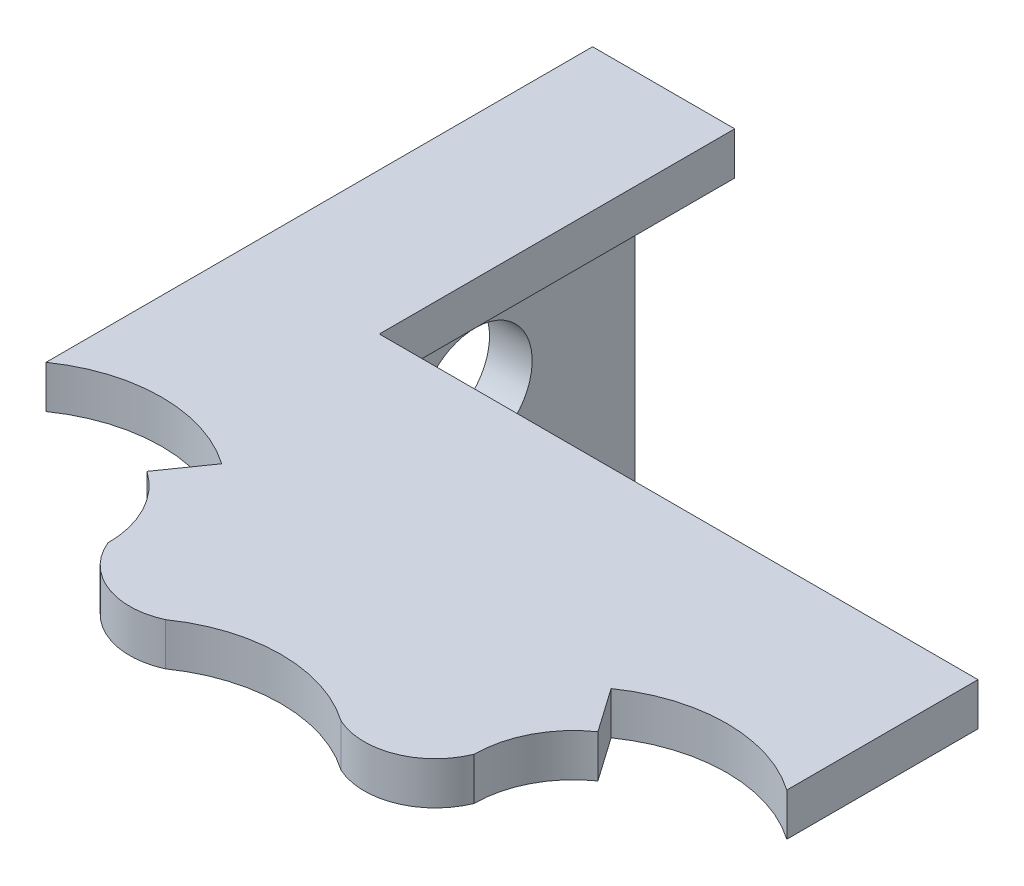
from build123d import *

# Parameters (mm, degrees)
BOSS_EXTRUDE1_DEPTH = 3
SKETCH3_W           = 3
SKETCH3_H           = 22.5
BOSS_EXTRUDE2_DEPTH = 25
SKETCH4_R           = 4
CUT_EXTRUDE1_DEPTH  = 3


with BuildPart() as part:
    # Sketch2 → Boss-Extrude1 (new body)
    with BuildSketch(Plane(origin=(0, 0, 0), x_dir=(1, 0, 0), z_dir=(0, 1, 0))):
        with BuildLine():
            Line((-15.860247962, 17.20906431), (-13.694996915, 20.301363277))
            ThreePointArc((-13.694996915, 20.301363277), (-19.875283017, 22.25), (-26.055569119, 20.301363277))
            Line((-26.055569119, 20.301363277), (-26.055569119, 33.75))
            Line((-26.055569119, 33.75), (-26.055569119, 58.75))
            Line((-26.055569119, 58.75), (-16.055569119, 58.75))
            Line((-16.055569119, 58.75), (-16.055569119, 33.75))
            Line((-16.055569119, 33.75), (26.055569119, 33.75))
            Line((26.055569119, 33.75), (26.055569119, 20.301363277))
            ThreePointArc((26.055569119, 20.301363277), (19.875283017, 22.25), (13.694996915, 20.301363277))
            Line((13.694996915, 20.301363277), (15.860247962, 17.20906431))
            ThreePointArc((15.860247962, 17.20906431), (13.666207185, 14.707240293), (12.875283017, 11.475))
            ThreePointArc((12.875283017, 11.475), (10.090653959, 8.727908609), (6.180286102, 8.826363277))
            ThreePointArc((6.180286102, 8.826363277), (0, 10.775), (-6.180286102, 8.826363277))
            ThreePointArc((-6.180286102, 8.826363277), (-10.090653959, 8.727908609), (-12.875283017, 11.475))
            ThreePointArc((-12.875283017, 11.475), (-13.666207185, 14.707240293), (-15.860247962, 17.20906431))
        make_face()
    extrude(amount=BOSS_EXTRUDE1_DEPTH)

    # Sketch3 → Boss-Extrude2 (add)
    with BuildSketch(Plane.XZ):
        with Locations((-24.555569119, -47.5)):
            Rectangle(SKETCH3_W, SKETCH3_H)
    extrude(amount=BOSS_EXTRUDE2_DEPTH)

    # Sketch4 → Cut-Extrude1 (cut)
    with BuildSketch(Plane.ZY.offset(26.055569119)):
        with Locations((-47.5, -11)):
            Circle(SKETCH4_R)
    extrude(amount=-CUT_EXTRUDE1_DEPTH, mode=Mode.SUBTRACT)


solid = part.part
